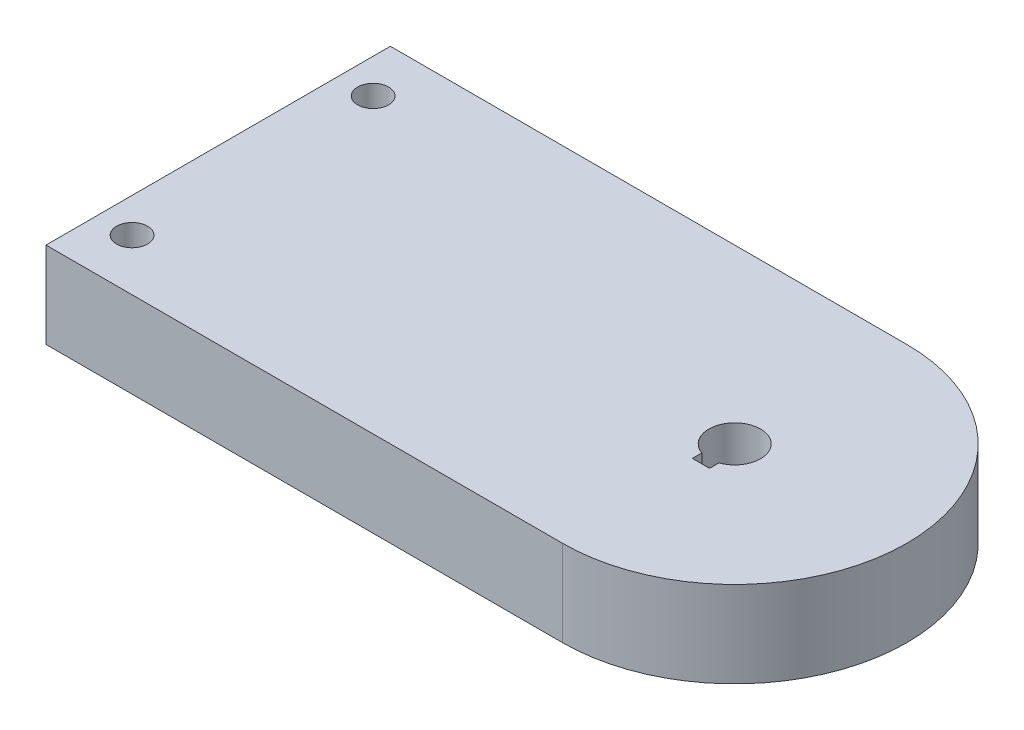
from build123d import *

# Parameters (mm, degrees)
DODANIE_WYCI_GNI_CIE1_DEPTH                         = 25
POG_BIENIE_WALCOWE_POD_M8_WKR_T_Z_BEM_W_D           = 9
POG_BIENIE_WALCOWE_POD_M8_WKR_T_Z_BEM_W_DEPTH       = 26.25
POG_BIENIE_WALCOWE_POD_M8_WKR_T_Z_BEM_W_CBORE_D     = 15
POG_BIENIE_WALCOWE_POD_M8_WKR_T_Z_BEM_W_CBORE_DEPTH = 8.6
POG_BIENIE_WALCOWE_POD_M8_WKR_T_Z_BEM_W_TIP         = 2.703872786
WYTNIJ_WYCI_GNI_CIE1_DEPTH                          = 15


with BuildPart() as part:
    # Szkic1 → Dodanie-wyciągnięcie1 (new body)
    with BuildSketch(Plane(origin=(0, 0, 0), x_dir=(1, 0, 0), z_dir=(0, 1, 0))):
        with BuildLine():
            Line((0, -50), (0, 50))
            Line((0, 50), (150, 50))
            ThreePointArc((150, 50), (200, 0), (150, -50))
            Line((150, -50), (0, -50))
        make_face()
        with BuildLine():
            Line((147.5, -9.8), (152.5, -9.8))
            Line((152.5, -9.8), (152.5, -7.071067812))
            ThreePointArc((152.5, -7.071067812), (150, 7.5), (147.5, -7.071067812))
            Line((147.5, -7.071067812), (147.5, -9.8))
        make_face(mode=Mode.SUBTRACT)
    extrude(amount=DODANIE_WYCI_GNI_CIE1_DEPTH)

    # Pogłębienie walcowe pod M8 Wkręt z łbem walcowym z gniazdem sześciokątnym1
    with Locations(Plane(origin=(10, 0, 35), x_dir=(0, 0, -1), z_dir=(0, -1, 0))):
        with Locations((0, 0), (70, 0)):
            CounterBoreHole(POG_BIENIE_WALCOWE_POD_M8_WKR_T_Z_BEM_W_D / 2, POG_BIENIE_WALCOWE_POD_M8_WKR_T_Z_BEM_W_CBORE_D / 2, POG_BIENIE_WALCOWE_POD_M8_WKR_T_Z_BEM_W_CBORE_DEPTH, depth=POG_BIENIE_WALCOWE_POD_M8_WKR_T_Z_BEM_W_DEPTH)
            with Locations((0, 0, -(POG_BIENIE_WALCOWE_POD_M8_WKR_T_Z_BEM_W_DEPTH + POG_BIENIE_WALCOWE_POD_M8_WKR_T_Z_BEM_W_TIP / 2))):  # 118° drill point
                Cone(0, POG_BIENIE_WALCOWE_POD_M8_WKR_T_Z_BEM_W_D / 2, POG_BIENIE_WALCOWE_POD_M8_WKR_T_Z_BEM_W_TIP, mode=Mode.SUBTRACT)

    # Szkic4 → Wytnij-wyciągnięcie1 (cut)
    with BuildSketch(Plane.XZ):
        with BuildLine():
            Line((31.213273393, 33.297016557), (66.968494236, 4.684692061))
            ThreePointArc((66.968494236, 4.684692061), (69.219673049, 0), (66.968494236, -4.684692061))
            Line((66.968494236, -4.684692061), (31.213273393, -33.297016557))
            ThreePointArc((31.213273393, -33.297016557), (25.923625146, -33.899773139), (23.089255738, -29.393106506))
            Line((23.089255738, -29.393106506), (23.089255738, 29.393106506))
            ThreePointArc((23.089255738, 29.393106506), (25.923625146, 33.899773139), (31.213273393, 33.297016557))
        make_face()
        with BuildLine():
            Line((41.341249338, -43), (112.306649775, -43))
            ThreePointArc((112.306649775, -43), (117.024676389, -39.655362459), (115.430667431, -34.096089949))
            Line((115.430667431, -34.096089949), (83.071984868, -8.201770072))
            ThreePointArc((83.071984868, -8.201770072), (76.823949557, -6.009590175), (70.575914246, -8.201770072))
            Line((70.575914246, -8.201770072), (38.217231683, -34.096089949))
            ThreePointArc((38.217231683, -34.096089949), (36.623222725, -39.655362459), (41.341249338, -43))
        make_face()
        with BuildLine():
            Line((130.558643376, -29.393106506), (130.558643376, 29.393106506))
            ThreePointArc((130.558643376, 29.393106506), (127.724273968, 33.899773139), (122.43462572, 33.297016557))
            Line((122.43462572, 33.297016557), (86.679404878, 4.684692061))
            ThreePointArc((86.679404878, 4.684692061), (84.428226064, 0), (86.679404878, -4.684692061))
            Line((86.679404878, -4.684692061), (122.43462572, -33.297016557))
            ThreePointArc((122.43462572, -33.297016557), (127.724273968, -33.899773139), (130.558643376, -29.393106506))
        make_face()
        with BuildLine():
            Line((41.341249338, 43), (112.306649775, 43))
            ThreePointArc((112.306649775, 43), (117.024676389, 39.655362459), (115.430667431, 34.096089949))
            Line((115.430667431, 34.096089949), (83.071984868, 8.201770072))
            ThreePointArc((83.071984868, 8.201770072), (76.823949557, 6.009590175), (70.575914246, 8.201770072))
            Line((70.575914246, 8.201770072), (38.217231683, 34.096089949))
            ThreePointArc((38.217231683, 34.096089949), (36.623222725, 39.655362459), (41.341249338, 43))
        make_face()
    extrude(amount=-WYTNIJ_WYCI_GNI_CIE1_DEPTH, mode=Mode.SUBTRACT)


solid = part.part
